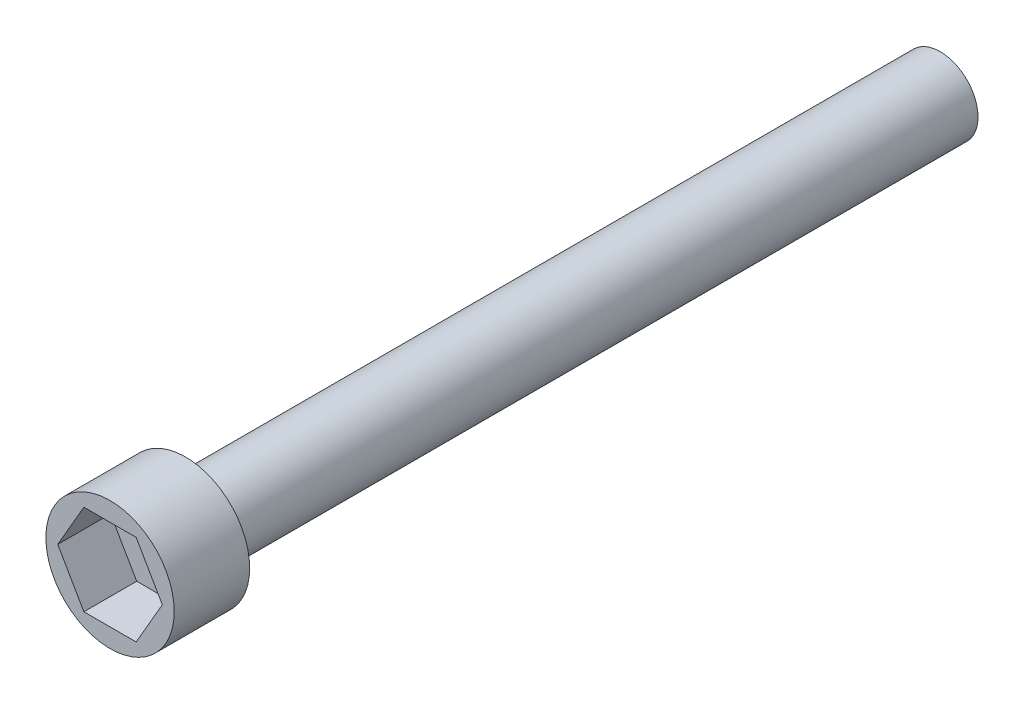
from build123d import *

# Parameters (mm, degrees)
ESQUISSE1_R             = 2.5
BOSS_EXTRU_1_DEPTH      = 50
ESQUISSE2_R             = 4.25
BOSS_EXTRU_2_DEPTH      = 5
ENL_V_MAT_EXTRU_1_DEPTH = 3.5


with BuildPart() as part:
    # Esquisse1 → Boss.-Extru.1 (new body)
    with BuildSketch(Plane.XY):
        Circle(ESQUISSE1_R)
    extrude(amount=BOSS_EXTRU_1_DEPTH)

    # Esquisse2 → Boss.-Extru.2 (add)
    with BuildSketch(Plane.XY.offset(50)):
        Circle(ESQUISSE2_R)
    extrude(amount=BOSS_EXTRU_2_DEPTH)

    # Esquisse3 → Enlèv. mat.-Extru.1 (cut)
    with BuildSketch(Plane.XY.offset(55)):
        Polygon((3.464101615, 0), (1.732050808, 3), (-1.732050808, 3), (-3.464101615, 0), (-1.732050808, -3), (1.732050808, -3), align=None)
    extrude(amount=-ENL_V_MAT_EXTRU_1_DEPTH, mode=Mode.SUBTRACT)


solid = part.part
